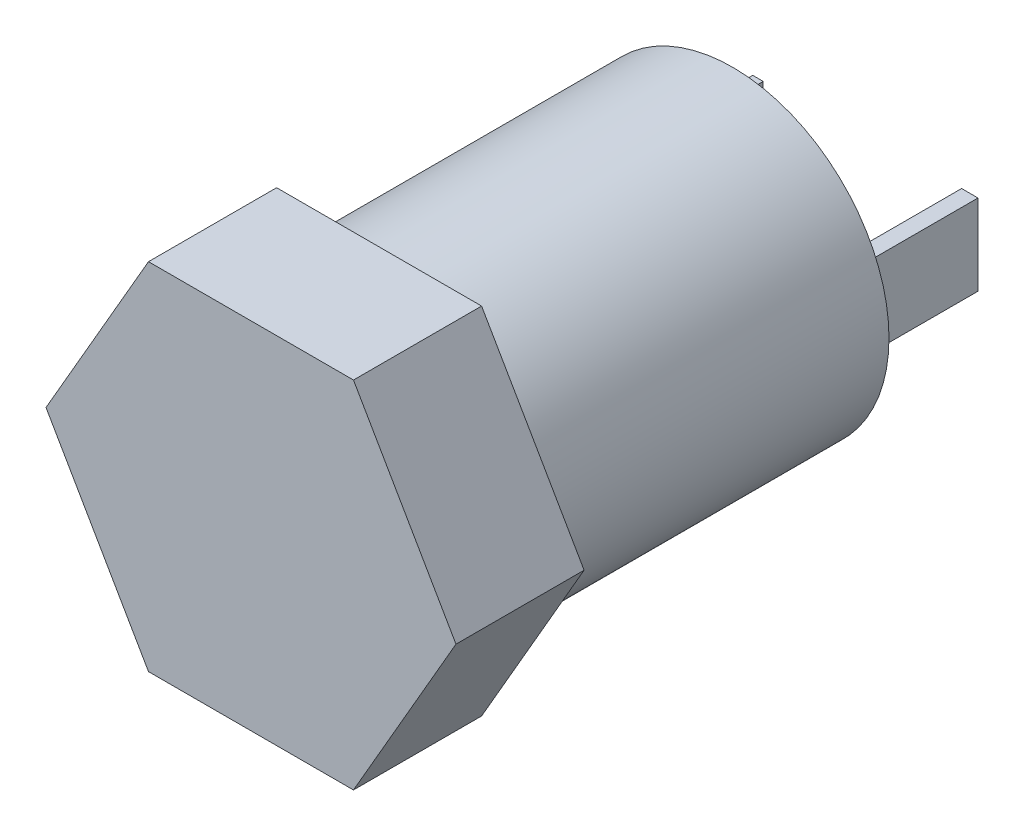
from build123d import *

# Parameters (mm, degrees)
EXTRUDE_1_DEPTH = 5
SKETCH_2_R      = 6.1
EXTRUDE_2_DEPTH = 13.8
SKETCH_3_W      = 0.639470974
SKETCH_3_H      = 3.15167837
SKETCH_3_W_2    = 0.411088483
SKETCH_3_H_2    = 2.90045763
EXTRUDE_3_DEPTH = 5.2


with BuildPart() as part:
    # 草图1 → 凸台-拉伸1 (new body)
    with BuildSketch(Plane.XY):
        Polygon((8, 0), (4, 6.92820323), (-4, 6.92820323), (-8, 0), (-4, -6.92820323), (4, -6.92820323), align=None)
    extrude(amount=EXTRUDE_1_DEPTH)

    # 草图2 → 凸台-拉伸2 (add)
    with BuildSketch(Plane(origin=(0, 0, 0), x_dir=(-1, 0, 0), z_dir=(0, 0, -1))):
        with Locations(Location((0, 0, 0), (0, 0, 180))):
            Circle(SKETCH_2_R)
    extrude(amount=EXTRUDE_2_DEPTH)

    # 草图3 → 凸台-拉伸3 (add)
    with BuildSketch(Plane(origin=(0, 0, -13.8), x_dir=(-1, 0, 0), z_dir=(0, 0, -1))):
        with Locations((-4.053789208, -0.308316362)):
            Rectangle(SKETCH_3_W, SKETCH_3_H)
        with Locations((4.213656952, -0.433926732)):
            Rectangle(SKETCH_3_W_2, SKETCH_3_H_2)
    extrude(amount=EXTRUDE_3_DEPTH)


solid = part.part
